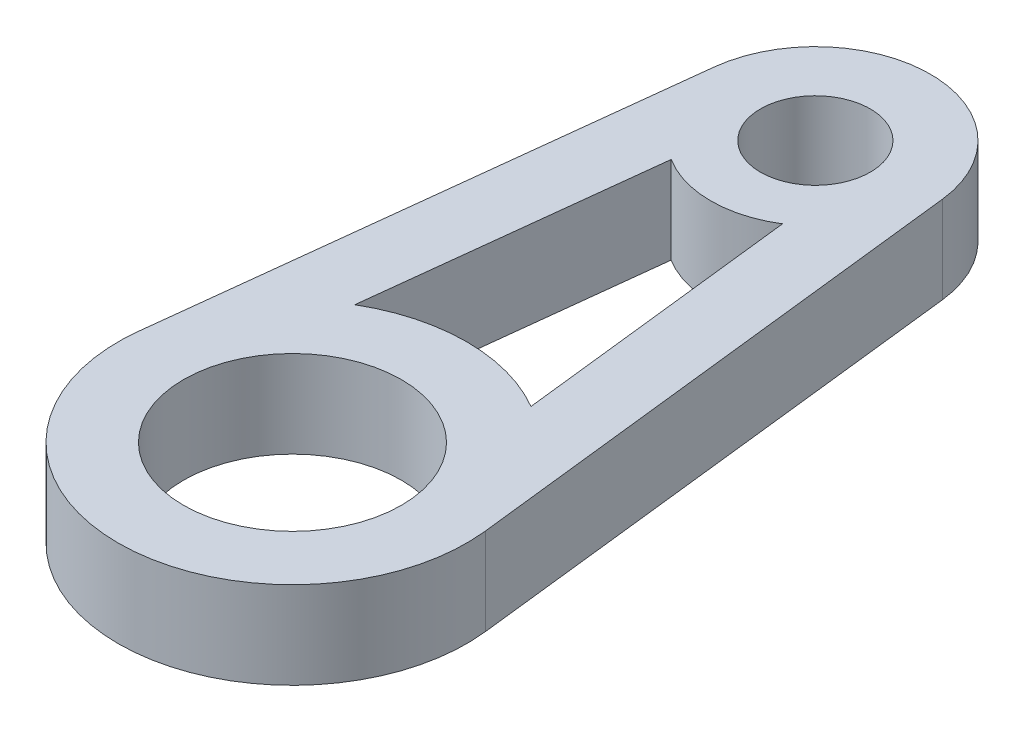
from build123d import *

# Parameters (mm, degrees)
SKETCH2_R           = 2
SKETCH2_R_2         = 3.96875
BOSS_EXTRUDE1_DEPTH = 3.175


with BuildPart() as part:
    # Sketch2 → Boss-Extrude1 (new body)
    with BuildSketch(Plane(origin=(0, 0, 0), x_dir=(1, 0, 0), z_dir=(0, 1, 0))):
        with BuildLine():
            Line((4.163997478, 0.47498), (6.309087088, -18.330333333))
            ThreePointArc((6.309087088, -18.330333333), (0, -25.4), (-6.309087088, -18.330333333))
            Line((-6.309087088, -18.330333333), (-4.163997478, 0.47498))
            ThreePointArc((-4.163997478, 0.47498), (0, 4.191), (4.163997478, 0.47498))
        make_face()
        with Locations(Location((0, 0, 0), (0, 0, 270))):
            Circle(SKETCH2_R, mode=Mode.SUBTRACT)
        with Locations(Location((0, -19.05, 0), (0, 0, 270))):
            Circle(SKETCH2_R_2, mode=Mode.SUBTRACT)
        with BuildLine():
            Line((3.20971892, -13.570930329), (2.029515364, -3.224463891))
            ThreePointArc((2.029515364, -3.224463891), (0, -3.81), (-2.029515364, -3.224463891))
            Line((-2.029515364, -3.224463891), (-3.20971892, -13.570930329))
            ThreePointArc((-3.20971892, -13.570930329), (0, -12.7), (3.20971892, -13.570930329))
        make_face(mode=Mode.SUBTRACT)
    extrude(amount=BOSS_EXTRUDE1_DEPTH)


solid = part.part
